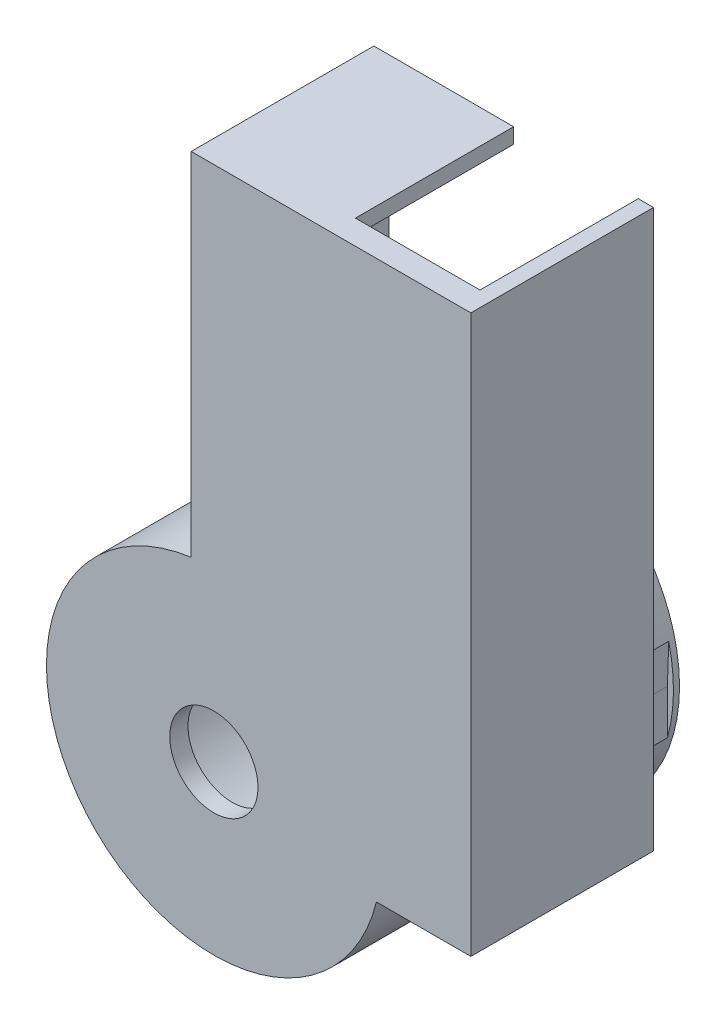
from build123d import *
from build123d.topology import SkipClean

# Parameters (mm, degrees)
BOSS_EXTRUDE1_DEPTH     = 24
CUT_EXTRUDE1_DEPTH      = 91.21363533302491
CUT_EXTRUDE1_DEPTH_BACK = 91.21363533302491
SKETCH2_4_R             = 16.25
CUT_EXTRUDE2_DEPTH      = 3
CUT_EXTRUDE2_DEPTH_BACK = 48
SKETCH2_5_R             = 19.5
SKETCH2_5_R_2           = 16.25
CUT_EXTRUDE3_DEPTH      = 48
CUT_EXTRUDE3_DEPTH_BACK = 16
SKETCH3_W               = 8.5
SKETCH3_H               = 14.200000000000006
CUT_EXTRUDE4_DEPTH      = 40
SKETCH7_R               = 27.499999999999996
SKETCH7_R_2             = 18.9
BOSS_EXTRUDE2_DEPTH     = 1
SKETCH8_W               = 181.3602376825947
SKETCH8_H               = 155.21218123297842
CUT_EXTRUDE5_DEPTH      = 48
BOSS_EXTRUDE3_START     = 48
SKETCH9_R               = 27.499999999999996
SKETCH9_R_2             = 18.9
BOSS_EXTRUDE3_DEPTH     = 48
CUT_EXTRUDE6_DEPTH      = 48
BOSS_EXTRUDE4_DEPTH     = 4
EXTRUDE_THIN2_DEPTH     = 30
CUT_EXTRUDE8_START      = -21
CUT_EXTRUDE8_DEPTH      = 21
BOSS_EXTRUDE5_DEPTH     = 21
CUT_EXTRUDE9_DEPTH      = 21
CUT_EXTRUDE10_DEPTH     = 5
SKETCH21_R              = 27.499999999999996
SKETCH21_R_2            = 7.25
BOSS_EXTRUDE6_DEPTH     = 3


with BuildPart() as part:
    # Sketch2 → Boss-Extrude1 (new, symmetric)
    with BuildSketch(Plane.XY):
        with BuildLine():
            ThreePointArc((-24.69493875270801, -42.900000000000006), (1.68e-15, -82.5), (24.694938752708016, -42.9))
            ThreePointArc((24.694938752708016, -42.9), (21.124860801609124, -27.49999999999999), (24.694938752708012, -12.099999999999996))
            ThreePointArc((24.694938752708012, -12.099999999999996), (3.42e-15, 27.499999999999996), (-24.694938752708012, -12.100000000000001))
            ThreePointArc((-24.694938752708012, -12.100000000000001), (-21.124860801609117, -27.500000000000004), (-24.69493875270801, -42.900000000000006))
        make_face()
    extrude(amount=BOSS_EXTRUDE1_DEPTH, both=True)

    # Sketch2<4> → Cut-Extrude1 (cut, two sides: drawn at the far end of the back side and taken through both)
    with BuildSketch(Plane.XY.offset(-CUT_EXTRUDE1_DEPTH_BACK)):
        with Locations((6.74e-15, -55)):
            Circle(SKETCH2_4_R)
    extrude(amount=CUT_EXTRUDE1_DEPTH + CUT_EXTRUDE1_DEPTH_BACK, mode=Mode.SUBTRACT)

    # Sketch2<5> → Cut-Extrude2 (cut, two sides: drawn at the far end of the back side and taken through both)
    with BuildSketch(Plane.XY.offset(-CUT_EXTRUDE2_DEPTH_BACK)):
        with Locations((6.74e-15, -55)):
            Circle(SKETCH2_5_R)
        with Locations((6.74e-15, -55)):
            Circle(SKETCH2_5_R_2, mode=Mode.SUBTRACT)
    extrude(amount=CUT_EXTRUDE2_DEPTH + CUT_EXTRUDE2_DEPTH_BACK, mode=Mode.SUBTRACT)

    # Sketch2<6> → Cut-Extrude3 (cut, two sides: drawn at the far end of the back side and taken through both)
    with BuildSketch(Plane.XY.offset(-CUT_EXTRUDE3_DEPTH_BACK)):
        Polygon((10.399999999999997, 20.400000000000002), (-10.400000000000002, 20.400000000000002), (-10.399999999999999, -20.399999999999995), (10.400000000000002, -20.399999999999995), align=None)
    extrude(amount=CUT_EXTRUDE3_DEPTH + CUT_EXTRUDE3_DEPTH_BACK, mode=Mode.SUBTRACT)

    # Sketch3 → Cut-Extrude4 (cut)
    with BuildSketch(Plane.XY.offset(24)):
        with Locations((0, 27.500000000000007)):
            Rectangle(SKETCH3_W, SKETCH3_H)
    extrude(amount=-CUT_EXTRUDE4_DEPTH, mode=Mode.SUBTRACT)

    # Sketch7 → Boss-Extrude2 (add)
    with BuildSketch(Plane(origin=(0, 0, -24), x_dir=(-1, 0, 0), z_dir=(0, 0, -1))):
        with Locations((-6.74e-15, -55)):
            Circle(SKETCH7_R)
        with Locations((-6.74e-15, -55)):
            Circle(SKETCH7_R_2, mode=Mode.SUBTRACT)
    extrude(amount=BOSS_EXTRUDE2_DEPTH)

    # Sketch8 → Cut-Extrude5 (cut)
    with BuildSketch(Plane.XY.offset(24)):
        with Locations((-25.06580059332441, -26.494305521168478)):
            Rectangle(SKETCH8_W, SKETCH8_H)
    extrude(amount=-CUT_EXTRUDE5_DEPTH, mode=Mode.SUBTRACT)

    # Sketch9 → Boss-Extrude3 (add)
    with SkipClean():  # the faces are left unmerged after this step: merging them gives an invalid solid
        with BuildSketch(Plane.XY.offset(-24).offset(BOSS_EXTRUDE3_START)):
            with Locations(Location((6.74e-15, -55, 0), (0, 0, 180))):
                Circle(SKETCH9_R)
            with Locations((6.74e-15, -55)):
                Circle(SKETCH9_R_2, mode=Mode.SUBTRACT)
        extrude(amount=-BOSS_EXTRUDE3_DEPTH)

    # Sketch10 → Cut-Extrude6 (cut)
    with SkipClean():  # the faces are left unmerged after this step: merging them gives an invalid solid
        with BuildSketch(Plane.XY.offset(24)):
            with BuildLine():
                Line((26.717930940571712, -48.48830542371335), (26.510281823927063, -55))
                Line((26.510281823927063, -55), (26.510281823927063, -62.311289736835946))
                ThreePointArc((26.51028182392707, -62.311289736835946), (27.25144721072622, -58.68898697761363), (27.500000000000014, -55))
                ThreePointArc((27.500000000000014, -55), (27.30378271289276, -51.72075472598662), (26.717930940571723, -48.48830542371334))
            make_face()
            with BuildLine():
                ThreePointArc((-5.604082705298323, -81.92293180603063), (6e-15, -82.5), (5.604082705298339, -81.92293180603063))
                Line((5.604082705298337, -81.92293180603063), (6.74e-15, -81.92293180603063))
                Line((7.11e-15, -81.92293180603063), (-5.604082705298323, -81.92293180603063))
            make_face()
        extrude(amount=-CUT_EXTRUDE6_DEPTH, mode=Mode.SUBTRACT)

    # Sketch11 → Boss-Extrude4 (add)
    with SkipClean():  # the faces are left unmerged after this step: merging them gives an invalid solid
        with BuildSketch(Plane.XY.offset(24)):
            with BuildLine():
                ThreePointArc((27.500000000000025, -55.00000000000003), (27.300326018506244, -58.3078995273848), (26.7042036884893, -61.56776258429582))
                Line((26.70420368848926, -61.56776258429563), (42.21724684134985, -61.56776258429563))
                Line((42.21724684134985, -61.56776258429563), (42.21724684134985, 29.98869686217629))
                Line((42.21724684134985, 29.988696862176287), (-3.7193423220770256, 29.988696862176287))
                Line((-3.719342322077025, 29.988696862176287), (-3.719342322077025, -27.7526791648939))
                ThreePointArc((-3.719342322077028, -27.7526791648939), (15.483065545848751, -32.27282064789051), (26.717930940571723, -48.488305423713314))
                ThreePointArc((26.717930940571723, -48.488305423713314), (27.303782712892772, -51.72075472598662), (27.500000000000025, -55.00000000000002))
            make_face()
        extrude(amount=-BOSS_EXTRUDE4_DEPTH)

    # Sketch16 → Extrude-Thin2 (add)
    with SkipClean():  # the faces are left unmerged after this step: merging them gives an invalid solid
        with BuildSketch(Plane(origin=(0, 0, 24), x_dir=(-1, 0, 0), z_dir=(0, 0, -1))):
            with BuildLine():
                Line((-26.704203688489347, -61.56776258429563), (-42.21724684134985, -61.56776258429563))
                Line((-42.21724684134985, -61.56776258429563), (-42.21724684134985, 29.988696862176287))
                Line((-42.21724684134985, 29.988696862176287), (3.719342322077025, 29.988696862176287))
                Line((3.719342322077025, 29.988696862176287), (3.719342322077025, -27.75267916489391))
                ThreePointArc((3.719342322077025, -27.75267916489391), (-20.443603637167037, -36.60682000505511), (-26.704203688489347, -61.56776258429563))
            make_face()
            with BuildLine():
                Line((-29.722942444479006, -59.06776258429563), (-39.71724684134985, -59.06776258429563))
                Line((-39.71724684134985, -59.06776258429563), (-39.71724684134985, 27.48869686217629))
                Line((-39.71724684134985, 27.48869686217629), (1.2193423220770256, 27.488696862176287))
                Line((1.2193423220770256, 27.488696862176287), (1.2193423220770252, -25.02479017084956))
                ThreePointArc((1.2193423220770252, -25.02479017084956), (-22.200108055370485, -34.82191281786335), (-29.722942444479006, -59.06776258429563))
            make_face(mode=Mode.SUBTRACT)
        extrude(amount=EXTRUDE_THIN2_DEPTH)

    # Sketch17 → Cut-Extrude8 (cut)
    with BuildSketch(Plane(origin=(0, 0, -5.999999999999998), x_dir=(-1, 0, 0), z_dir=(0, 0, -1)).offset(CUT_EXTRUDE8_START)):
        with BuildLine():
            Line((1.3487027041970006, -27.53309262010562), (1.2193423220770252, -25.02479017084956))
            ThreePointArc((1.2193423220770252, -25.02479017084956), (-22.20010805537015, -34.82191281786366), (-29.72294244447902, -59.06776258429561))
            Line((-29.72294244447902, -59.06776258429561), (-27.19748715520997, -59.06776258429561))
            ThreePointArc((-27.19748715520997, -59.06776258429561), (-20.38746592483553, -36.54461506324843), (1.3487027041970006, -27.53309262010562))
        make_face()
    extrude(amount=CUT_EXTRUDE8_DEPTH, mode=Mode.SUBTRACT)

    # Sketch18 → Boss-Extrude5 (add)
    with BuildSketch(Plane(origin=(0, 0, 20), x_dir=(-1, 0, 0), z_dir=(0, 0, -1))):
        with BuildLine():
            ThreePointArc((-27.19748715520984, -50.93223741570337), (-17.949742740939968, -34.16597169210712), (-1.0275e-13, -27.499999999999904))
            Line((-1.0275e-13, -27.499999999999908), (-11.98957880828152, -27.499999999999908))
            ThreePointArc((-11.98957880828161, -27.49999999999943), (-20.951294804022364, -33.528082385707165), (-27.197487155209934, -42.33916699256241))
            Line((-27.197487155209956, -42.339166992562404), (-27.197487155209956, -50.93223741570336))
        make_face()
    extrude(amount=BOSS_EXTRUDE5_DEPTH)

    # Sketch19 → Cut-Extrude9 (cut)
    with BuildSketch(Plane(origin=(0, 0, -5.999999999999998), x_dir=(-1, 0, 0), z_dir=(0, 0, -1))):
        Polygon((-39.71724684134985, 27.48869686217629), (-39.71724684134984, 29.988696862176287), (-19.248952259636408, 29.988696862176287), (-19.24895225963641, 27.48869686217629), align=None)
    extrude(amount=-CUT_EXTRUDE9_DEPTH, mode=Mode.SUBTRACT)

    # Sketch20 → Cut-Extrude10 (cut)
    with BuildSketch(Plane(origin=(0, 0, 15.000000000000004), x_dir=(-1, 0, 0), z_dir=(0, 0, -1))):
        Polygon((-19.248952259636408, 29.988696862176287), (-39.71724684134984, 29.988696862176287), (-39.71724684134984, 27.48869686217629), (-19.24895225963641, 27.48869686217629), align=None)
    extrude(amount=-CUT_EXTRUDE10_DEPTH, mode=Mode.SUBTRACT)

    # Sketch21 → Boss-Extrude6 (add)
    with BuildSketch(Plane.XY.offset(24)):
        with Locations(Location((6.74e-15, -55, 0), (0, 0, 180))):
            Circle(SKETCH21_R)
        with Locations((6.74e-15, -55)):
            Circle(SKETCH21_R_2, mode=Mode.SUBTRACT)
    extrude(amount=-BOSS_EXTRUDE6_DEPTH)


solid = part.part
